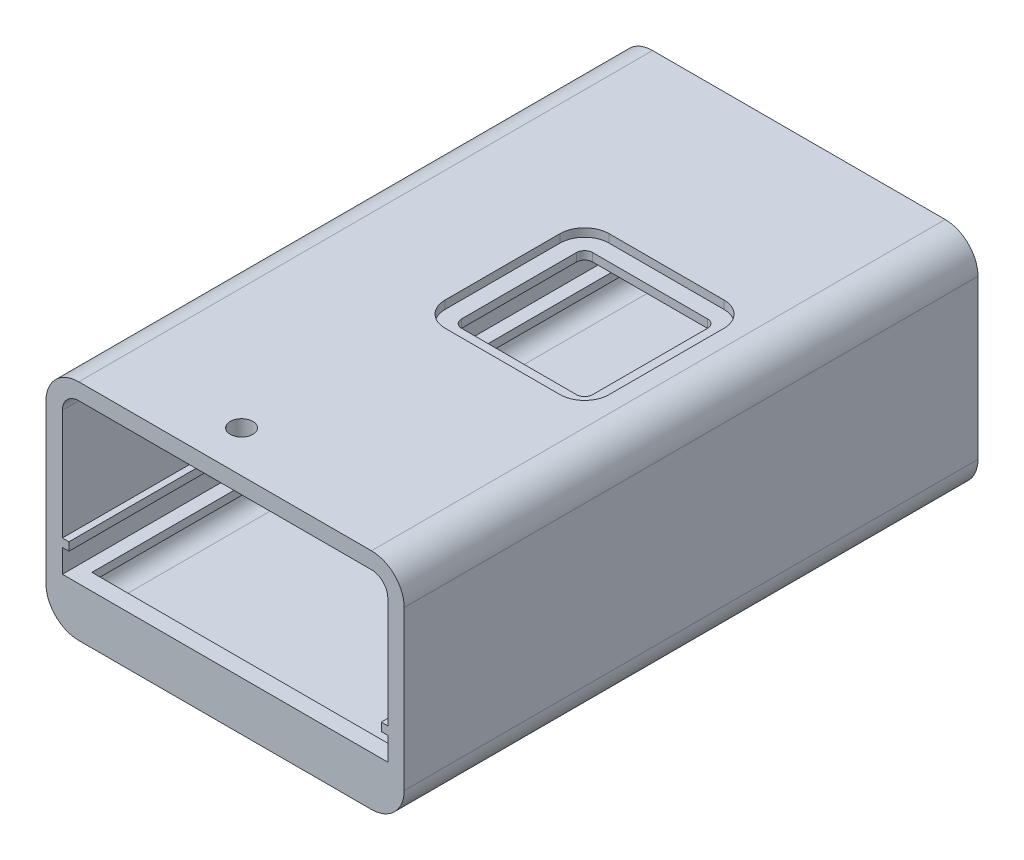
from build123d import *

# Parameters (mm, degrees)
BOSS_EXTRUDE1_DEPTH                 = 88.9
SKETCH2_W                           = 50.419
SKETCH2_H                           = 2.54
BOSS_EXTRUDE2_DEPTH                 = 6.223
F_3_0MM_CLEARANCE_DOWEL_HOLE1_D     = 3.5
F_3_0MM_CLEARANCE_DOWEL_HOLE1_DEPTH = 2.54
CUT_EXTRUDE1_DEPTH                  = 7.62
CUT_EXTRUDE2_DEPTH                  = 1.27


with BuildPart() as part:
    # Sketch1 → Boss-Extrude1 (new body)
    with BuildSketch(Plane.XY):
        with BuildLine():
            Line((17.122726154, 10.071647692), (17.122726154, 34.626647692))
            ThreePointArc((17.122726154, 34.626647692), (15.634828602, 38.218750141), (12.042726154, 39.706647692))
            Line((12.042726154, 39.706647692), (-33.296273846, 39.706647692))
            ThreePointArc((-33.296273846, 39.706647692), (-36.888376295, 38.218750141), (-38.376273846, 34.626647692))
            Line((-38.376273846, 34.626647692), (-38.376273846, 10.071647692))
            ThreePointArc((-38.376273846, 10.071647692), (-36.888376295, 6.479545244), (-33.296273846, 4.991647692))
            Line((-33.296273846, 4.991647692), (12.042726154, 4.991647692))
            ThreePointArc((12.042726154, 4.991647692), (15.634828602, 6.479545244), (17.122726154, 10.071647692))
        make_face()
        with BuildLine():
            Line((-35.836273846, 16.211647692), (-34.820273846, 16.211647692))
            Line((-34.820273846, 16.211647692), (-34.820273846, 17.481647692))
            Line((-34.820273846, 17.481647692), (-35.836273846, 17.481647692))
            Line((-35.836273846, 17.481647692), (-35.836273846, 34.626647692))
            ThreePointArc((-35.836273846, 34.626647692), (-35.09232507, 36.422698917), (-33.296273846, 37.166647692))
            Line((-33.296273846, 37.166647692), (12.042726154, 37.166647692))
            ThreePointArc((12.042726154, 37.166647692), (13.838777378, 36.422698917), (14.582726154, 34.626647692))
            Line((14.582726154, 34.626647692), (14.582726154, 17.481647692))
            Line((14.582726154, 17.481647692), (13.566726154, 17.481647692))
            Line((13.566726154, 17.481647692), (13.566726154, 16.211647692))
            Line((13.566726154, 16.211647692), (14.582726154, 16.211647692))
            Line((14.582726154, 16.211647692), (14.582726154, 12.611647692))
            Line((14.582726154, 12.611647692), (12.550726154, 12.611647692))
            Line((12.550726154, 12.611647692), (12.550726154, 11.341647692))
            Line((12.550726154, 11.341647692), (14.582726154, 11.341647692))
            Line((14.582726154, 11.341647692), (14.582726154, 10.071647692))
            ThreePointArc((14.582726154, 10.071647692), (13.838777378, 8.275596468), (12.042726154, 7.531647692))
            Line((12.042726154, 7.531647692), (-33.296273846, 7.531647692))
            ThreePointArc((-33.296273846, 7.531647692), (-35.09232507, 8.275596468), (-35.836273846, 10.071647692))
            Line((-35.836273846, 10.071647692), (-35.836273846, 11.341647692))
            Line((-35.836273846, 11.341647692), (-33.804273846, 11.341647692))
            Line((-33.804273846, 11.341647692), (-33.804273846, 12.611647692))
            Line((-33.804273846, 12.611647692), (-35.836273846, 12.611647692))
            Line((-35.836273846, 12.611647692), (-35.836273846, 16.211647692))
        make_face(mode=Mode.SUBTRACT)
    extrude(amount=BOSS_EXTRUDE1_DEPTH)

    # Sketch2 → Boss-Extrude2 (add)
    with BuildSketch(Plane(origin=(0, 12.611647692, 0), x_dir=(1, 0, 0), z_dir=(0, 1, 0))):
        with Locations((-10.626773846, -87.63)):
            Rectangle(SKETCH2_W, SKETCH2_H)
    extrude(amount=-BOSS_EXTRUDE2_DEPTH)

    # Ø3.0mm Clearance Dowel Hole1
    with Locations(Plane(origin=(-44.550497372, 37.166647692, -20.932340184), x_dir=(-1, 0, 0), z_dir=(0, -1, 0))):
        with Locations((-30.050223526, -103.406140184)):
            Hole(F_3_0MM_CLEARANCE_DOWEL_HOLE1_D / 2, depth=F_3_0MM_CLEARANCE_DOWEL_HOLE1_DEPTH)

    # Sketch7 → Cut-Extrude1 (cut)
    with BuildSketch(Plane(origin=(0, 39.706647692, 0), x_dir=(1, 0, 0), z_dir=(0, 1, 0))):
        with BuildLine():
            Line((6.962726154, -31.75), (6.962726154, -49.53))
            ThreePointArc((6.962726154, -49.53), (6.590751766, -50.428025612), (5.692726154, -50.8))
            Line((5.692726154, -50.8), (-12.087273846, -50.8))
            ThreePointArc((-12.087273846, -50.8), (-12.985299458, -50.428025612), (-13.357273846, -49.53))
            Line((-13.357273846, -49.53), (-13.357273846, -31.75))
            ThreePointArc((-13.357273846, -31.75), (-12.985299458, -30.851974388), (-12.087273846, -30.48))
            Line((-12.087273846, -30.48), (5.692726154, -30.48))
            ThreePointArc((5.692726154, -30.48), (6.590751766, -30.851974388), (6.962726154, -31.75))
        make_face()
    extrude(amount=-CUT_EXTRUDE1_DEPTH, mode=Mode.SUBTRACT)

    # Sketch7<3> → Cut-Extrude2 (cut)
    with BuildSketch(Plane(origin=(0, 39.706647692, 0), x_dir=(1, 0, 0), z_dir=(0, 1, 0))):
        with BuildLine():
            Line((5.692726154, -27.94), (-12.087273846, -27.94))
            ThreePointArc((-12.087273846, -27.94), (-14.781350682, -29.055923164), (-15.897273846, -31.75))
            Line((-15.897273846, -31.75), (-15.897273846, -49.53))
            ThreePointArc((-15.897273846, -49.53), (-14.781350682, -52.224076836), (-12.087273846, -53.34))
            Line((-12.087273846, -53.34), (5.692726154, -53.34))
            ThreePointArc((5.692726154, -53.34), (8.38680299, -52.224076836), (9.502726154, -49.53))
            Line((9.502726154, -49.53), (9.502726154, -31.75))
            ThreePointArc((9.502726154, -31.75), (8.38680299, -29.055923164), (5.692726154, -27.94))
        make_face()
        with BuildLine():
            Line((6.962726154, -31.75), (6.962726154, -49.53))
            ThreePointArc((6.962726154, -49.53), (6.590751766, -50.428025612), (5.692726154, -50.8))
            Line((5.692726154, -50.8), (-12.087273846, -50.8))
            ThreePointArc((-12.087273846, -50.8), (-12.985299458, -50.428025612), (-13.357273846, -49.53))
            Line((-13.357273846, -49.53), (-13.357273846, -31.75))
            ThreePointArc((-13.357273846, -31.75), (-12.985299458, -30.851974388), (-12.087273846, -30.48))
            Line((-12.087273846, -30.48), (5.692726154, -30.48))
            ThreePointArc((5.692726154, -30.48), (6.590751766, -30.851974388), (6.962726154, -31.75))
        make_face(mode=Mode.SUBTRACT)
    extrude(amount=-CUT_EXTRUDE2_DEPTH, mode=Mode.SUBTRACT)


solid = part.part
